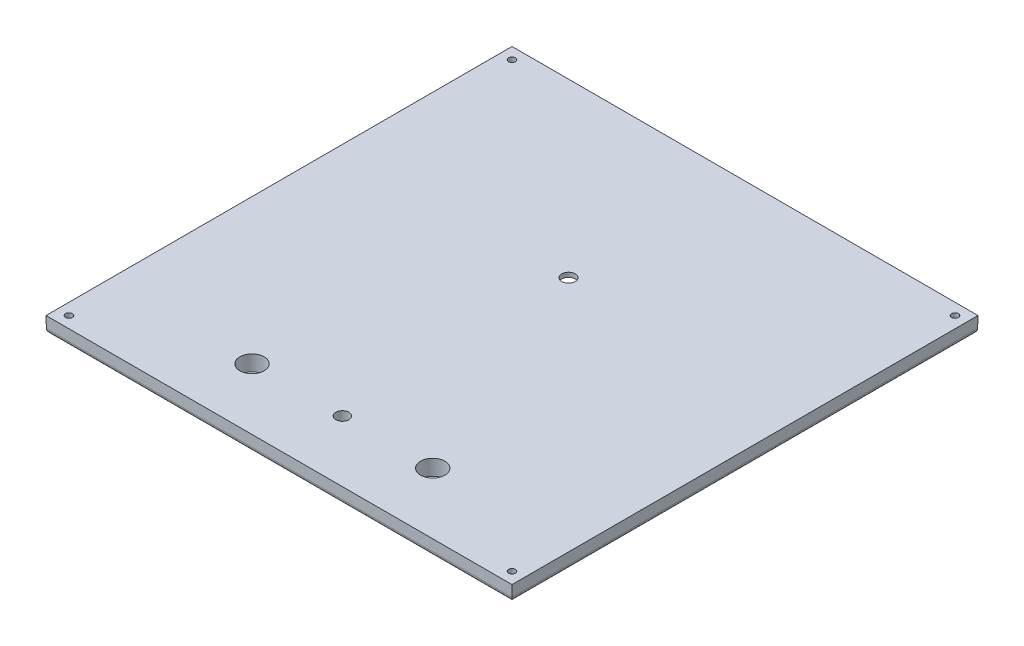
from build123d import *

# Parameters (mm, degrees)
SKETCH1_W                  = 206
SKETCH1_H                  = 206
MAINBOSS_DEPTH             = 7
MAINBOSS_DRAFT             = -1
SKETCH4_R                  = 70
TRAYCUT_DEPTH              = 5
TRAYCUT_DRAFT              = -1
SKETCH5_R                  = 3
TRAYHOLE_DEPTH             = 7
TRAYHOLE_DRAFT             = -1
MAINFILLET_R               = 2
SKETCH6_R                  = 3
SHAFTHOLES_DEPTH           = 7
SHAFTHOLES_DRAFT           = -1
SKETCH6_R_2                = 5.5
SHAFTHOLES_PROFILE_2_DEPTH = 7
SHAFTHOLES_PROFILE_2_DRAFT = -1
SHAFTHOLES_PROFILE_3_DEPTH = 7
SHAFTHOLES_PROFILE_3_DRAFT = -1
SKETCH7_R                  = 1.5
BACKLEFTHOLDER_DEPTH       = 7
SKETCH8_R                  = 1.5
BACKRIGHTHOLDER_DEPTH      = 7
SKETCH9_R                  = 1.5
FRONTRIGHTHOLDER_DEPTH     = 7
SKETCH10_R                 = 1.5
FRONTLEFTHOLDER_DEPTH      = 7


with BuildPart() as part:
    # Sketch1 → MainBoss (with draft: the straight prism first)
    with BuildSketch(Plane(origin=(0, 0, 0), x_dir=(1, 0, 0), z_dir=(0, 1, 0))):
        Rectangle(SKETCH1_W, SKETCH1_H)
    extrude(amount=MAINBOSS_DEPTH)
    # MainBoss: the draft: its side faces are tilted about the plane it starts from
    mainboss_sides = [part.faces().sort_by_distance(p)[0] for p in [
        (-103, 3.5, 0),
        (0, 3.5, 103),
        (103, 3.5, 0),
        (0, 3.5, -103),
    ]]
    draft(mainboss_sides, Plane(origin=(0, 0, 0), x_dir=(1, 0, 0), z_dir=(0, 1, 0)), MAINBOSS_DRAFT)


with BuildPart() as traycut_tool:
    # Sketch4 → TrayCut (with draft: the straight prism first)
    with BuildSketch(Plane(origin=(0, 0, 0), x_dir=(-1, 0, 0), z_dir=(0, -1, 0))):
        with Locations((2, 27)):
            Circle(SKETCH4_R)
    extrude(amount=-TRAYCUT_DEPTH)
    # TrayCut: the draft: its side faces are tilted about the plane it starts from
    traycut_sides = [traycut_tool.faces().sort_by_distance(p)[0] for p in [
        (68, 2.5, -27),
    ]]
    draft(traycut_sides, Plane(origin=(0, 0, 0), x_dir=(-1, 0, 0), z_dir=(0, -1, 0)), TRAYCUT_DRAFT)


with BuildPart() as part_1:
    add(part.part)

    # TrayCut: cut by traycut_tool
    add(traycut_tool.part, mode=Mode.SUBTRACT)


with BuildPart() as trayhole_tool:
    # Sketch5 → TrayHole (with draft: the straight prism first)
    with BuildSketch(Plane.XZ.offset(-5)):
        with Locations((-2, -27)):
            Circle(SKETCH5_R)
    extrude(amount=-TRAYHOLE_DEPTH)
    # TrayHole: the draft: its side faces are tilted about the plane it starts from
    trayhole_sides = [trayhole_tool.faces().sort_by_distance(p)[0] for p in [
        (-5, 8.5, -27),
    ]]
    draft(trayhole_sides, Plane.XZ.offset(-5), TRAYHOLE_DRAFT)


with BuildPart() as part_2:
    add(part_1.part)

    # TrayHole: cut by trayhole_tool
    add(trayhole_tool.part, mode=Mode.SUBTRACT)

    # MainFillet
    mainfillet_edges = [part_2.edges().sort_by_distance(p)[0] for p in [
        (68, 0, -27),
        (-103, 0, 0),
        (0, 0, 103),
        (103, 0, 0),
        (0, 0, -103),
    ]]
    fillet(mainfillet_edges, radius=MAINFILLET_R)


with BuildPart() as shaftholes_tool:
    # Sketch6 → ShaftHoles (with draft: the straight prism first)
    with BuildSketch(Plane.XZ):
        with Locations((0.965394526, 76.05325216)):
            Circle(SKETCH6_R)
    extrude(amount=-SHAFTHOLES_DEPTH)
    # ShaftHoles: the draft: its side faces are tilted about the plane it starts from
    shaftholes_sides = [shaftholes_tool.faces().sort_by_distance(p)[0] for p in [
        (-2.034605474, 3.5, 76.05325216),
    ]]
    draft(shaftholes_sides, Plane.XZ, SHAFTHOLES_DRAFT)


with BuildPart() as part_3:
    add(part_2.part)

    # ShaftHoles: cut by shaftholes_tool
    add(shaftholes_tool.part, mode=Mode.SUBTRACT)


with BuildPart() as shaftholes_profile_2_tool:
    # Sketch6 → ShaftHoles profile 2 (with draft: the straight prism first)
    with BuildSketch(Plane.XZ):
        with Locations((-39.034601128, 76.034605474)):
            Circle(SKETCH6_R_2)
    extrude(amount=-SHAFTHOLES_PROFILE_2_DEPTH)
    # ShaftHoles profile 2: the draft: its side faces are tilted about the plane it starts from
    shaftholes_profile_2_sides = [shaftholes_profile_2_tool.faces().sort_by_distance(p)[0] for p in [
        (-44.534601128, 3.5, 76.034605474),
    ]]
    draft(shaftholes_profile_2_sides, Plane.XZ, SHAFTHOLES_PROFILE_2_DRAFT)


with BuildPart() as part_4:
    add(part_3.part)

    # ShaftHoles profile 2: cut by shaftholes_profile_2_tool
    add(shaftholes_profile_2_tool.part, mode=Mode.SUBTRACT)


with BuildPart() as shaftholes_profile_3_tool:
    # Sketch6 → ShaftHoles profile 3 (with draft: the straight prism first)
    with BuildSketch(Plane.XZ):
        with Locations((40.965394526, 76.05325216)):
            Circle(SKETCH6_R_2)
    extrude(amount=-SHAFTHOLES_PROFILE_3_DEPTH)
    # ShaftHoles profile 3: the draft: its side faces are tilted about the plane it starts from
    shaftholes_profile_3_sides = [shaftholes_profile_3_tool.faces().sort_by_distance(p)[0] for p in [
        (35.465394526, 3.5, 76.05325216),
    ]]
    draft(shaftholes_profile_3_sides, Plane.XZ, SHAFTHOLES_PROFILE_3_DRAFT)


with BuildPart() as part_5:
    add(part_4.part)

    # ShaftHoles profile 3: cut by shaftholes_profile_3_tool
    add(shaftholes_profile_3_tool.part, mode=Mode.SUBTRACT)

    # Sketch7 → BackLeftHolder (cut)
    with BuildSketch(Plane(origin=(0, 0, 0), x_dir=(-1, 0, 0), z_dir=(0, -1, 0))):
        with Locations(Location((98.034605474, -98.034605474, 0), (0, 0, 90))):
            Circle(SKETCH7_R)
    extrude(amount=-BACKLEFTHOLDER_DEPTH, mode=Mode.SUBTRACT)

    # Sketch8 → BackRightHolder (cut)
    with BuildSketch(Plane(origin=(0, 0, 0), x_dir=(-1, 0, 0), z_dir=(0, -1, 0))):
        with Locations(Location((-98.034605474, -98.034605474, 0), (0, 0, 90))):
            Circle(SKETCH8_R)
    extrude(amount=-BACKRIGHTHOLDER_DEPTH, mode=Mode.SUBTRACT)

    # Sketch9 → FrontRightHolder (cut)
    with BuildSketch(Plane(origin=(0, 0, 0), x_dir=(-1, 0, 0), z_dir=(0, -1, 0))):
        with Locations(Location((-98.034605474, 98.034605474, 0), (0, 0, 90))):
            Circle(SKETCH9_R)
    extrude(amount=-FRONTRIGHTHOLDER_DEPTH, mode=Mode.SUBTRACT)

    # Sketch10 → FrontLeftHolder (cut)
    with BuildSketch(Plane(origin=(0, 0, 0), x_dir=(-1, 0, 0), z_dir=(0, -1, 0))):
        with Locations(Location((98.034605474, 98.034605474, 0), (0, 0, 90))):
            Circle(SKETCH10_R)
    extrude(amount=-FRONTLEFTHOLDER_DEPTH, mode=Mode.SUBTRACT)


solid = part_5.part
